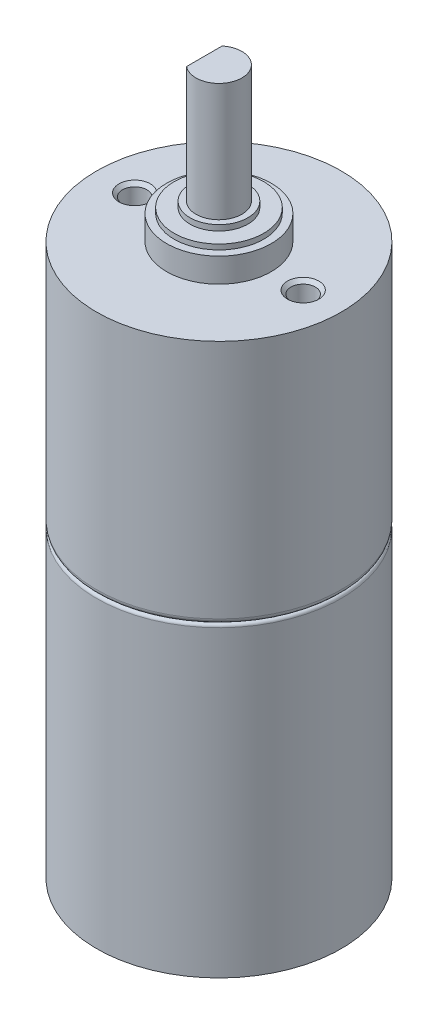
from build123d import *

# Parameters (mm, degrees)
M2X0_4_TAPPED_HOLE1_D           = 1.6
M2X0_4_TAPPED_HOLE1_DEPTH       = 12.0000014
M2X0_4_TAPPED_HOLE1_CSINK_D     = 2.05
M2X0_4_TAPPED_HOLE1_CSINK_ANGLE = 90
M2X0_4_TAPPED_HOLE1_TIP         = 0.480688495
CUT_EXTRUDE1_DEPTH              = 5.0165


with BuildPart() as part:
    # Sketch2 → Revolve1 (revolve)
    with BuildSketch(Plane.XY):
        with BuildLine():
            Line((0, 0), (2.713042009, 0))
            Line((2.713042009, 0), (2.713042009, 1.057855461))
            Line((2.713042009, 1.057855461), (7.9883, 1.057855461))
            Line((7.9883, 1.057855461), (7.9883, 20.863496467))
            ThreePointArc((7.9883, 20.863496467), (7.937074629, 20.995273421), (7.810296505, 21.057855461))
            ThreePointArc((7.810296505, 21.057855461), (7.9405339, 21.185977007), (7.9883, 21.362315629))
            Line((7.9883, 21.362315629), (7.9883, 37.057855461))
            Line((7.9883, 37.057855461), (3.4163, 37.057855461))
            Line((3.4163, 37.057855461), (3.4163, 38.64639819))
            Line((3.4163, 38.64639819), (2.924863894, 38.64639819))
            Line((2.924863894, 38.64639819), (2.924863894, 38.982086399))
            Line((2.924863894, 38.982086399), (1.888599244, 38.982086399))
            Line((1.888599244, 38.982086399), (1.888599244, 39.34639819))
            Line((1.888599244, 39.34639819), (1.5, 39.34639819))
            Line((1.5, 39.34639819), (1.5, 47.057855461))
            Line((1.5, 47.057855461), (0, 47.057855461))
            Line((0, 47.057855461), (0, 0))
        make_face()
    revolve(axis=Axis((0, 47.057855461, 0), (0, -1, 0)))

    # M2x0.4 Tapped Hole1
    with Locations(Plane(origin=(0, 37.057855461, 0), x_dir=(1, 0, 0), z_dir=(0, 1, 0))):
        with Locations((-5.5, 0), (5.5, 0)):
            CounterSinkHole(M2X0_4_TAPPED_HOLE1_D / 2, M2X0_4_TAPPED_HOLE1_CSINK_D / 2, depth=M2X0_4_TAPPED_HOLE1_DEPTH, counter_sink_angle=M2X0_4_TAPPED_HOLE1_CSINK_ANGLE)
            with Locations((0, 0, -(M2X0_4_TAPPED_HOLE1_DEPTH + M2X0_4_TAPPED_HOLE1_TIP / 2))):  # 118° drill point
                Cone(0, M2X0_4_TAPPED_HOLE1_D / 2, M2X0_4_TAPPED_HOLE1_TIP, mode=Mode.SUBTRACT)

    # Sketch6 → Cut-Extrude1 (cut)
    with BuildSketch(Plane(origin=(0, 47.057855461, 0), x_dir=(1, 0, 0), z_dir=(0, 1, 0))):
        with BuildLine():
            ThreePointArc((-0.9525, 1.158768204), (-1.5, 0), (-0.9525, -1.158768204))
            Line((-0.9525, -1.158768204), (-0.9525, 1.158768204))
        make_face()
    extrude(amount=-CUT_EXTRUDE1_DEPTH, mode=Mode.SUBTRACT)


solid = part.part
